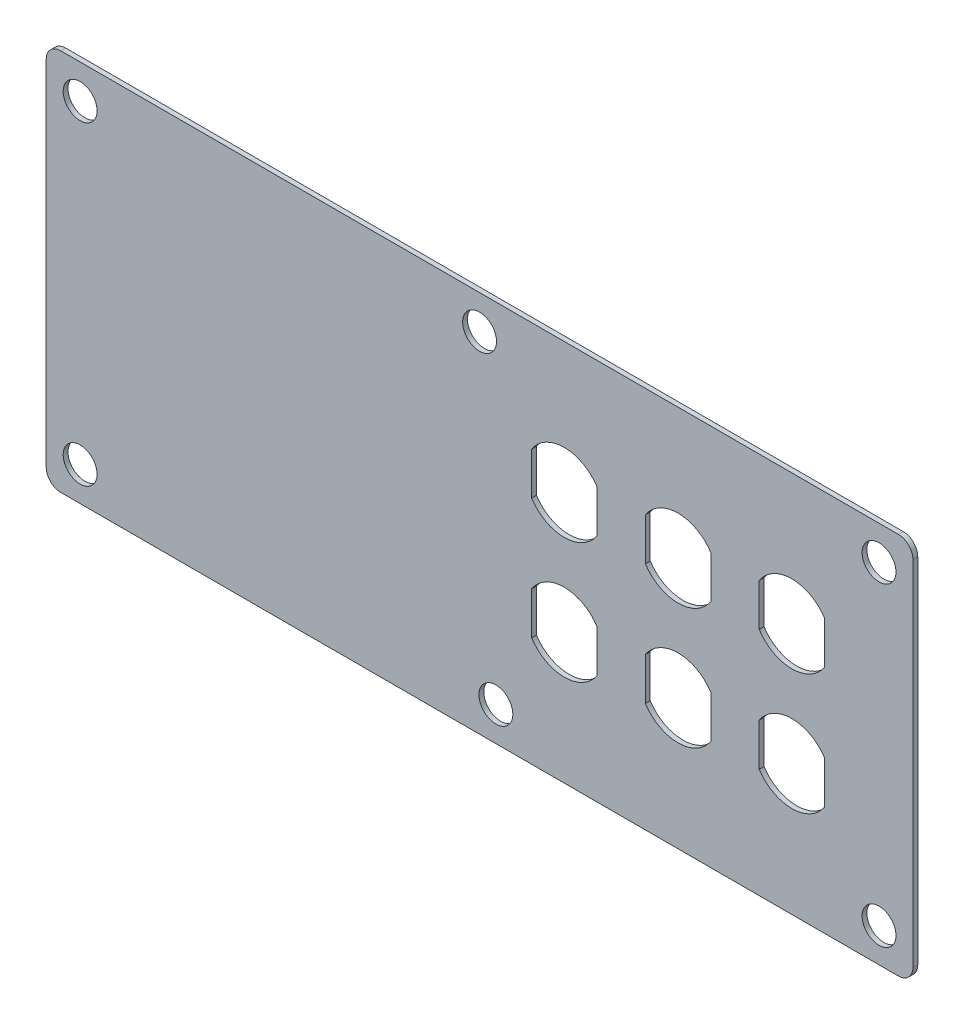
from build123d import *

# Parameters (mm, degrees)
SKETCH1_W                = 179
SKETCH1_H                = 78.998711306
BOSS_EXTRUDE1_DEPTH      = 1
FILLET1_R                = 3
CUT_EXTRUDE1_DEPTH       = 142.273697371
F_7_0_7_DIAMETER_HOLE1_D = 7
LPATTERN1_COUNT          = 3
LPATTERN1_PITCH          = 23.5
LPATTERN1_COPY_1_DEPTH   = 142.273697371
LPATTERN1_COPY_2_DEPTH   = 142.273697371


with BuildPart() as part:
    # Sketch1 → Boss-Extrude1 (new body)
    with BuildSketch(Plane.XY):
        with Locations((42, 12.124355653)):
            Rectangle(SKETCH1_W, SKETCH1_H)
    extrude(amount=BOSS_EXTRUDE1_DEPTH)

    # Fillet1
    fillet1_edges = [part.edges().sort_by_distance(p)[0] for p in [
        (131.5, -27.375, 0.5),
        (-47.5, -27.375, 0.5),
        (-47.5, 51.623711306, 0.5),
        (131.5, 51.623711306, 0.5),
    ]]
    fillet(fillet1_edges, radius=FILLET1_R)

    # Sketch4 → Cut-Extrude1 (cut, through all)
    with BuildSketch(Plane.XY.offset(1)):
        with BuildLine():
            Line((113.25, 20.237368866), (113.25, 29.010053746))
            ThreePointArc((113.25, 29.010053746), (106.5, 32.673711306), (99.75, 29.010053746))
            Line((99.75, 29.010053746), (99.75, 20.237368866))
            ThreePointArc((99.75, 20.237368866), (106.5, 16.573711306), (113.25, 20.237368866))
        make_face()
    cut_extrude1 = extrude(amount=-CUT_EXTRUDE1_DEPTH, mode=Mode.SUBTRACT)

    # Ø7.0 (7) Diameter Hole1 (through all)
    with Locations(Plane.XY.offset(1)):
        with Locations((42, 44.623711306), (-40.5, 44.623711306), (124.5, 44.623711306), (124.5, -20.375), (45.364988053, -20.375), (-40.5, -20.375)):
            Hole(F_7_0_7_DIAMETER_HOLE1_D / 2)

    # Mirror1: Cut-Extrude1 across plane
    add(cut_extrude1.mirror(Plane.ZX.offset(12.124355653)), mode=Mode.SUBTRACT)

    # LPattern1: Cut-Extrude1 ×3
    with Locations(*[(-i * LPATTERN1_PITCH, 0, 0) for i in range(1, LPATTERN1_COUNT)]):
        add(cut_extrude1, mode=Mode.SUBTRACT)

    # LPattern1 copy 1 sketch → LPattern1 copy 1 (cut, through all)
    with BuildSketch(Plane(origin=(-23.5, 24.248711306, 1), x_dir=(1, 0, 0), z_dir=(0, 0, 1))):
        with BuildLine():
            Line((113.25, -20.237368866), (113.25, -29.010053746))
            ThreePointArc((113.25, -29.010053746), (106.5, -32.673711306), (99.75, -29.010053746))
            Line((99.75, -29.010053746), (99.75, -20.237368866))
            ThreePointArc((99.75, -20.237368866), (106.5, -16.573711306), (113.25, -20.237368866))
        make_face()
    extrude(amount=-LPATTERN1_COPY_1_DEPTH, mode=Mode.SUBTRACT)

    # LPattern1 copy 2 sketch → LPattern1 copy 2 (cut, through all)
    with BuildSketch(Plane(origin=(-47, 24.248711306, 1), x_dir=(1, 0, 0), z_dir=(0, 0, 1))):
        with BuildLine():
            Line((113.25, -20.237368866), (113.25, -29.010053746))
            ThreePointArc((113.25, -29.010053746), (106.5, -32.673711306), (99.75, -29.010053746))
            Line((99.75, -29.010053746), (99.75, -20.237368866))
            ThreePointArc((99.75, -20.237368866), (106.5, -16.573711306), (113.25, -20.237368866))
        make_face()
    extrude(amount=-LPATTERN1_COPY_2_DEPTH, mode=Mode.SUBTRACT)


solid = part.part
